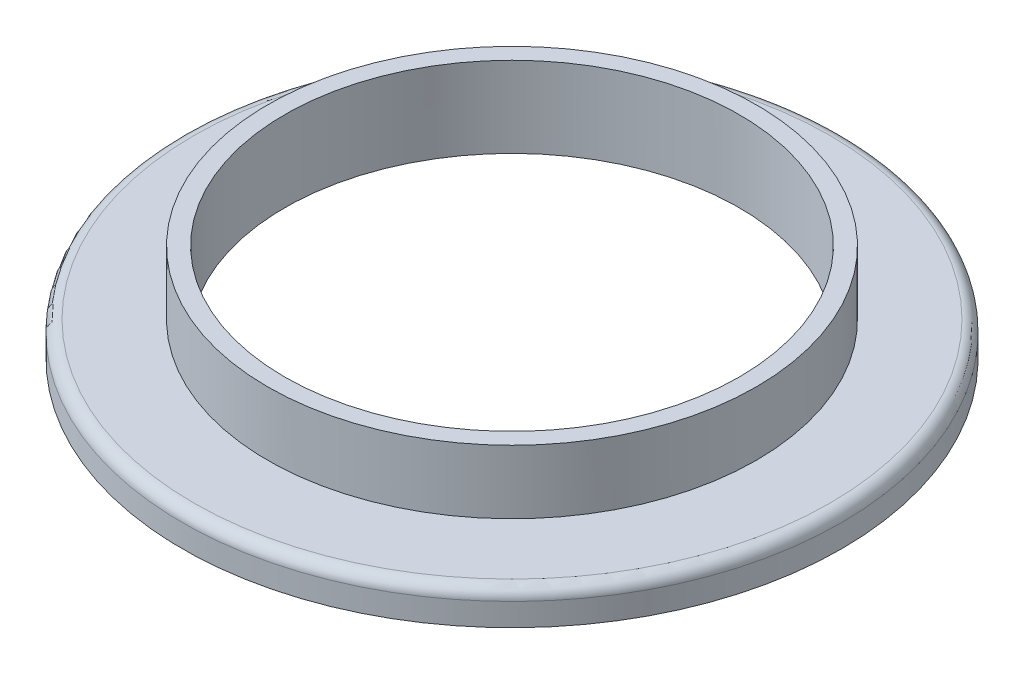
from build123d import *

# Parameters (mm, degrees)
SKETCH1_R                = 21.5
SKETCH1_R_2              = 20
BOSS_EXTRUDE1_DEPTH      = 10
CUT_EXTRUDE1_DEPTH       = 24
CUT_EXTRUDE1_DEPTH_BACK  = 27
SKETCH3_W                = 51.96152563
SKETCH3_H                = 7.978608452
BOSS_EXTRUDE2_DEPTH      = 1.5
BOSS_EXTRUDE2_DEPTH_BACK = 1.5
SKETCH4_R                = 29
SKETCH4_R_2              = 20
SKETCH6_R                = 27.5
CUT_EXTRUDE2_DEPTH       = 1.5
FILLET1_R                = 1


with BuildPart() as part:
    # Sketch1 → Boss-Extrude1 (new body)
    with BuildSketch(Plane(origin=(0, 0, 0), x_dir=(1, 0, 0), z_dir=(0, 1, 0))):
        Circle(SKETCH1_R)
        Circle(SKETCH1_R_2, mode=Mode.SUBTRACT)
    extrude(amount=BOSS_EXTRUDE1_DEPTH)

    # Sketch3 → Cut-Extrude1 (cut, two sides: drawn at the far end of the back side and taken through both)
    with BuildSketch(Plane.XY.offset(-CUT_EXTRUDE1_DEPTH_BACK)):
        with Locations((-1.240371902, -1.089304226)):
            Rectangle(SKETCH3_W, SKETCH3_H)
    extrude(amount=CUT_EXTRUDE1_DEPTH + CUT_EXTRUDE1_DEPTH_BACK, mode=Mode.SUBTRACT)

    # Sketch4 → Boss-Extrude2 (add, two sides: drawn at the far end of the back side and taken through both)
    with BuildSketch(Plane.XZ.offset(-2.9).offset(-BOSS_EXTRUDE2_DEPTH_BACK)):
        Circle(SKETCH4_R)
        Circle(SKETCH4_R_2, mode=Mode.SUBTRACT)
    extrude(amount=BOSS_EXTRUDE2_DEPTH + BOSS_EXTRUDE2_DEPTH_BACK)

    # Sketch6 → Cut-Extrude2 (cut)
    with BuildSketch(Plane.XZ.offset(-1.4)):
        Circle(SKETCH6_R)
    extrude(amount=-CUT_EXTRUDE2_DEPTH, mode=Mode.SUBTRACT)

    # Fillet1
    fillet1_edges = [part.edges().sort_by_distance(p)[0] for p in [
        (-29, 4.4, 0),
        (-27.5, 2.9, 0),
    ]]
    fillet(fillet1_edges, radius=FILLET1_R)


solid = part.part
